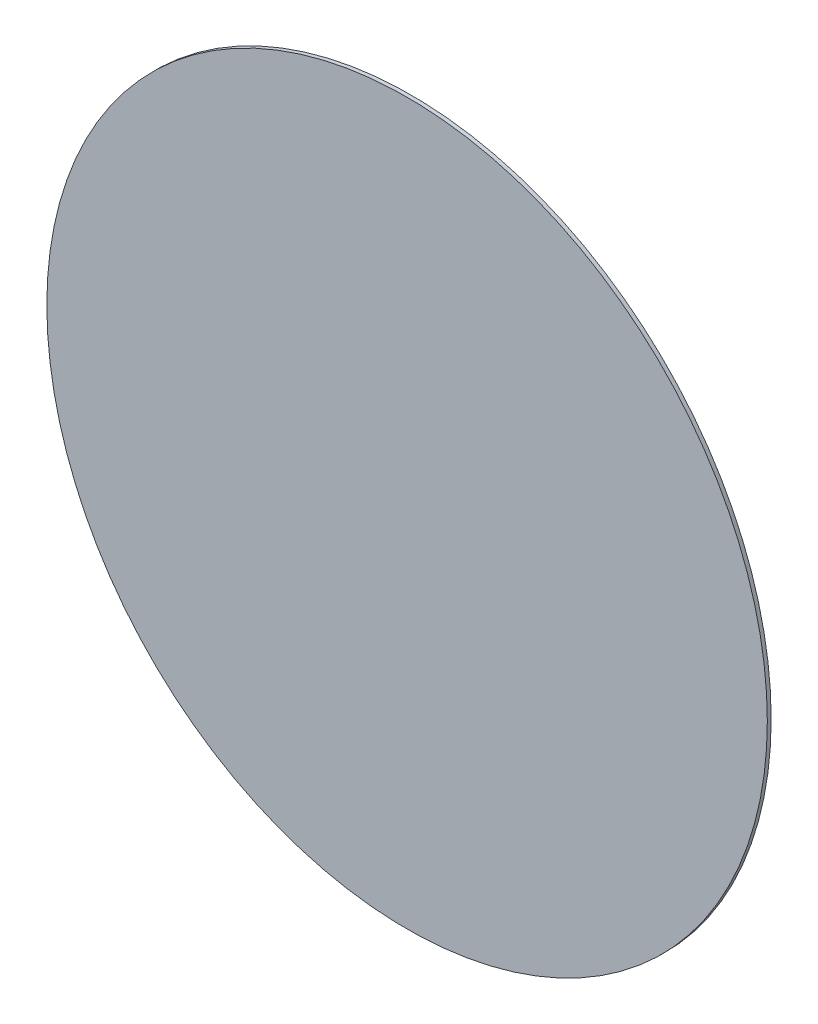
from build123d import *

# Parameters (mm, degrees)
PCB_OUTLINE_PILOT_R   = 150
PCB_1P6MM_PILOT_DEPTH = 1.6


with BuildPart() as part:
    # PCB_Outline_Pilot → PCB_1p6mm_Pilot (new body)
    with BuildSketch(Plane.XY):
        Circle(PCB_OUTLINE_PILOT_R)
    extrude(amount=PCB_1P6MM_PILOT_DEPTH)


solid = part.part
